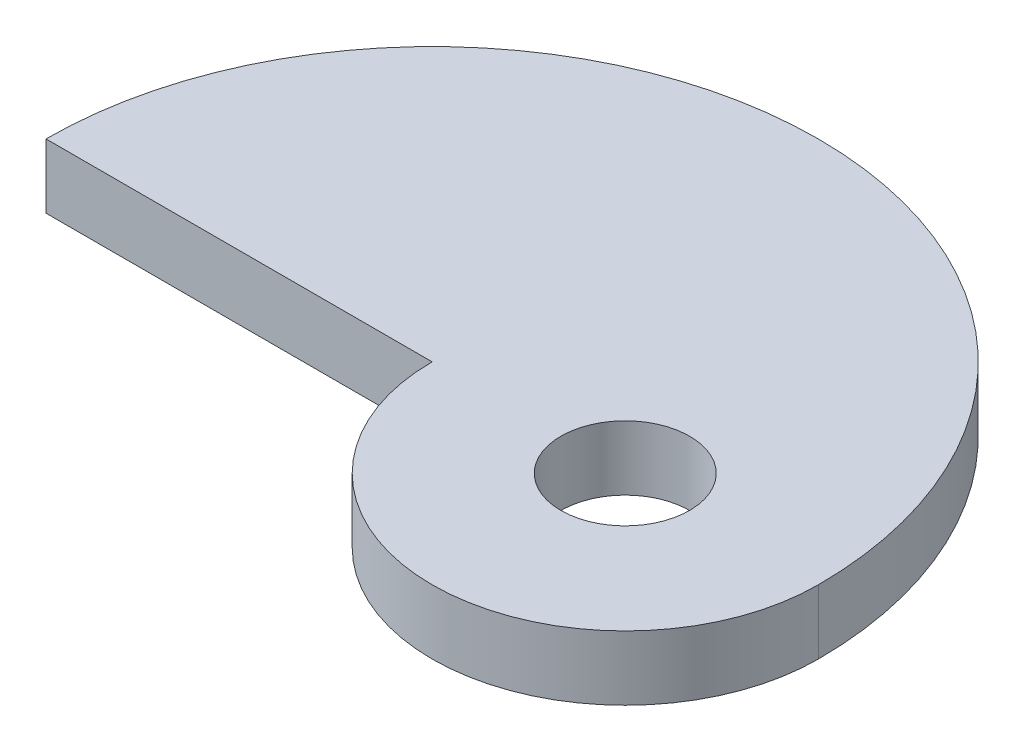
from build123d import *

# Parameters (mm, degrees)
BOSS_EXTRUDE2_DEPTH = 6.35
SKETCH3_R           = 6.35
CUT_EXTRUDE1_DEPTH  = 6.35


with BuildPart() as part:
    # Sketch2 → Boss-Extrude2 (new body)
    with BuildSketch(Plane(origin=(0, 0, 0), x_dir=(1, 0, 0), z_dir=(0, 1, 0))):
        with BuildLine():
            Line((0, 0), (0, 38.1))
            ThreePointArc((0, 38.1), (-26.940768363, 26.940768363), (-38.1, 0))
            Line((-38.1, 0), (0, 0))
        make_face()
        with BuildLine():
            Line((19.05, 0), (38.1, 0))
            ThreePointArc((38.1, 0), (26.940768363, 26.940768363), (0, 38.1))
            Line((0, 38.1), (0, 0))
            Line((0, 0), (19.05, 0))
        make_face()
        with BuildLine():
            Line((19.05, -19.05), (19.05, 0))
            Line((19.05, 0), (38.1, 0))
            ThreePointArc((38.1, 0), (32.520384182, -13.470384182), (19.05, -19.05))
        make_face()
        with BuildLine():
            Line((0, 0), (19.05, 0))
            Line((19.05, 0), (19.05, -19.05))
            ThreePointArc((19.05, -19.05), (5.579615818, -13.470384182), (0, 0))
        make_face()
    extrude(amount=BOSS_EXTRUDE2_DEPTH)

    # Sketch3 → Cut-Extrude1 (cut)
    with BuildSketch(Plane(origin=(0, 6.35, 0), x_dir=(1, 0, 0), z_dir=(0, 1, 0))):
        with Locations(Location((19.05, 0, 0), (0, 0, 270))):
            Circle(SKETCH3_R)
    extrude(amount=-CUT_EXTRUDE1_DEPTH, mode=Mode.SUBTRACT)


solid = part.part
